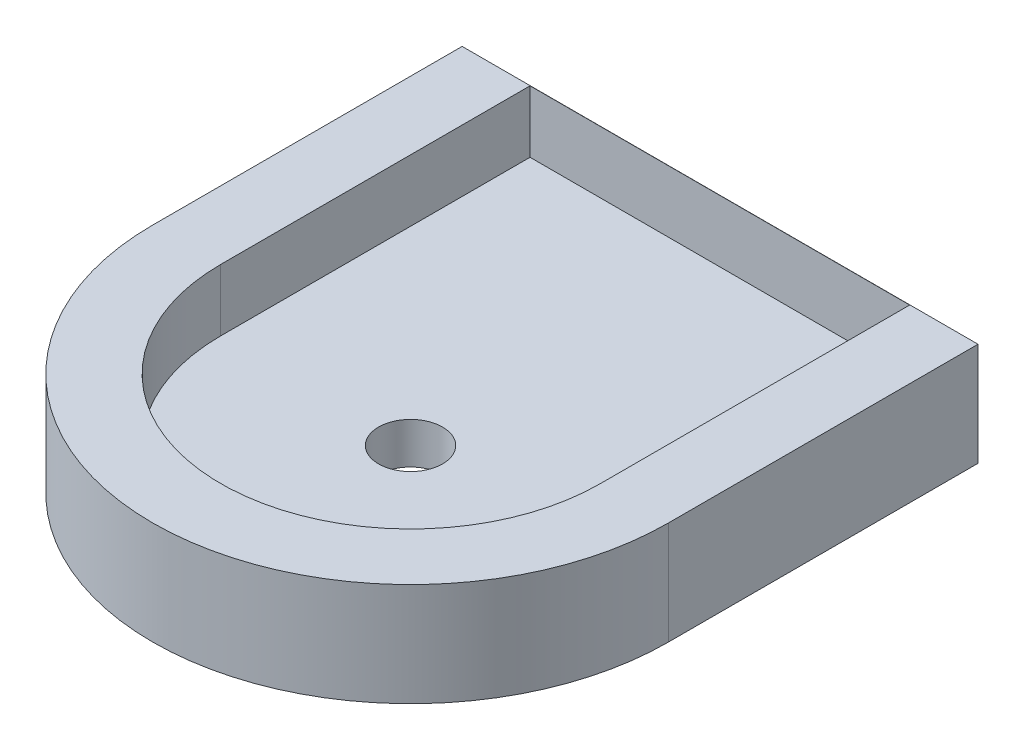
from build123d import *

# Parameters (mm, degrees)
SKETCH_1_R           = 2.55
SKETCH_1_R_2         = 7.5
EXTRUDE_1_DEPTH      = 5
FILLET_2_R           = 5
CUT_EXTRUDE_1_DEPTH  = 109.559891304
EXTRUDE_2_DEPTH      = 5
SKETCH_3_R           = 1.55
CUT_EXTRUDE_2_DEPTH  = 109.559891304
FILLET_3_R           = 2
SKETCH_5_R           = 3
CUT_EXTRUDE_3_DEPTH  = 3
SKETCH_6_OUTSIDE_W   = 117.274
SKETCH_6_OUTSIDE_H   = 115.837
SKETCH_6_OUTSIDE_W_2 = 25
SKETCH_6_OUTSIDE_H_2 = 29.920384019
CUT_EXTRUDE_4_DEPTH  = 109.559891304
EXTRUDE_START        = -2
SKETCH_7_R           = 1.55
EXTRUDE_3_DEPTH      = 2
SKETCH_8_W           = 18.4
SKETCH_8_H           = 0.01
EXTRUDE_4_DEPTH      = 3


with BuildPart() as part:
    # ｽｹｯﾁ1 → ﾎﾞｽ - 押し出し1 (new body)
    with BuildSketch(Plane(origin=(0, 0, 0), x_dir=(1, 0, 0), z_dir=(0, 1, 0))):
        with BuildLine():
            Line((0, 0), (0, -48))
            ThreePointArc((0, -48), (12.5, -60.5), (25, -48))
            Line((25, -48), (25, -20))
            Line((25, -20), (90, -20))
            Line((90, -20), (90, 30))
            Line((90, 30), (0, 0))
        make_face()
        with Locations(Location((75.769750529, 14.715657976, 0), (0, 0, 270))):
            Circle(SKETCH_1_R, mode=Mode.SUBTRACT)
        with Locations(Location((75, -10, 0), (0, 0, 270))):
            Circle(SKETCH_1_R, mode=Mode.SUBTRACT)
        with Locations(Location((25, -10, 0), (0, 0, 270))):
            Circle(SKETCH_1_R, mode=Mode.SUBTRACT)
        with Locations(Location((12.5, -48, 0), (0, 0, 270))):
            Circle(SKETCH_1_R_2, mode=Mode.SUBTRACT)
    extrude(amount=EXTRUDE_1_DEPTH)

    # ﾌｨﾚｯﾄ2
    fillet_2_edges = [part.edges().sort_by_distance(p)[0] for p in [
        (90, 2.5, -30),
        (90, 2.5, 20),
    ]]
    fillet(fillet_2_edges, radius=FILLET_2_R)

    # ｽｹｯﾁ2 → ｶｯﾄ - 押し出し1 (cut, through all)
    with BuildSketch(Plane(origin=(0, 5, 0), x_dir=(1, 0, 0), z_dir=(0, 1, 0))):
        with BuildLine():
            Line((3.3, -48), (3.3, -33))
            Line((3.3, -33), (21.7, -33))
            Line((21.7, -33), (21.7, -48))
            ThreePointArc((21.7, -48), (12.5, -57.2), (3.3, -48))
        make_face()
    extrude(amount=-CUT_EXTRUDE_1_DEPTH, mode=Mode.SUBTRACT)

    # ｽｹｯﾁ4 → ﾎﾞｽ - 押し出し2 (add)
    with BuildSketch(Plane(origin=(0, 5, 0), x_dir=(1, 0, 0), z_dir=(0, 1, 0))):
        Polygon((0, 0), (0, 20), (60, 20), align=None)
    extrude(amount=-EXTRUDE_2_DEPTH)

    # ｽｹｯﾁ3 → ｶｯﾄ - 押し出し2 (cut, through all)
    with BuildSketch(Plane(origin=(0, 5, 0), x_dir=(1, 0, 0), z_dir=(0, 1, 0))):
        with Locations(Location((20.5, 5, 0), (0, 0, 270))):
            Circle(SKETCH_3_R)
        with Locations(Location((4.5, 5, 0), (0, 0, 90))):
            Circle(SKETCH_3_R)
    extrude(amount=-CUT_EXTRUDE_2_DEPTH, mode=Mode.SUBTRACT)

    # ﾌｨﾚｯﾄ3
    fillet_3_edges = [part.edges().sort_by_distance(p)[0] for p in [
        (60, 2.5, -20),
        (0, 2.5, -20),
    ]]
    fillet(fillet_3_edges, radius=FILLET_3_R)

    # ｽｹｯﾁ5 → ｶｯﾄ - 押し出し3 (cut)
    with BuildSketch(Plane.XZ.offset(-5)):
        with Locations(Location((4.5, -5, 0), (0, 0, 270))):
            Circle(SKETCH_5_R)
        with Locations(Location((20.5, -5, 0), (0, 0, 270))):
            Circle(SKETCH_5_R)
    extrude(amount=CUT_EXTRUDE_3_DEPTH, mode=Mode.SUBTRACT)

    # ｽｹｯﾁ6 outside → ｶｯﾄ - 押し出し4 (cut, through all)
    with BuildSketch(Plane(origin=(0, 5, 0), x_dir=(1, 0, 0), z_dir=(0, 1, 0))):
        with Locations((45, -16.2185)):
            Rectangle(SKETCH_6_OUTSIDE_W, SKETCH_6_OUTSIDE_H)
        with Locations((12.5, -47.96019201)):
            Rectangle(SKETCH_6_OUTSIDE_W_2, SKETCH_6_OUTSIDE_H_2, mode=Mode.SUBTRACT)
    extrude(amount=-CUT_EXTRUDE_4_DEPTH, mode=Mode.SUBTRACT)

    # ｽｹｯﾁ7 → ﾎﾞｽ - 押し出し3 (add)
    with BuildSketch(Plane.XZ.offset(EXTRUDE_START)):
        with BuildLine():
            Line((3.3, 33), (3.3, 48))
            ThreePointArc((3.3, 48), (12.5, 57.2), (21.7, 48))
            Line((21.7, 48), (21.7, 33))
            Line((21.7, 33), (3.3, 33))
        make_face()
        with Locations(Location((12.5, 48, 0), (0, 0, 270))):
            Circle(SKETCH_7_R, mode=Mode.SUBTRACT)
    extrude(amount=EXTRUDE_3_DEPTH)

    # ｽｹｯﾁ8 → ﾎﾞｽ - 押し出し4 (add)
    with BuildSketch(Plane(origin=(0, 2, 0), x_dir=(1, 0, 0), z_dir=(0, 1, 0))):
        with Locations((12.5, -33.005)):
            Rectangle(SKETCH_8_W, SKETCH_8_H)
    extrude(amount=EXTRUDE_4_DEPTH)


solid = part.part
